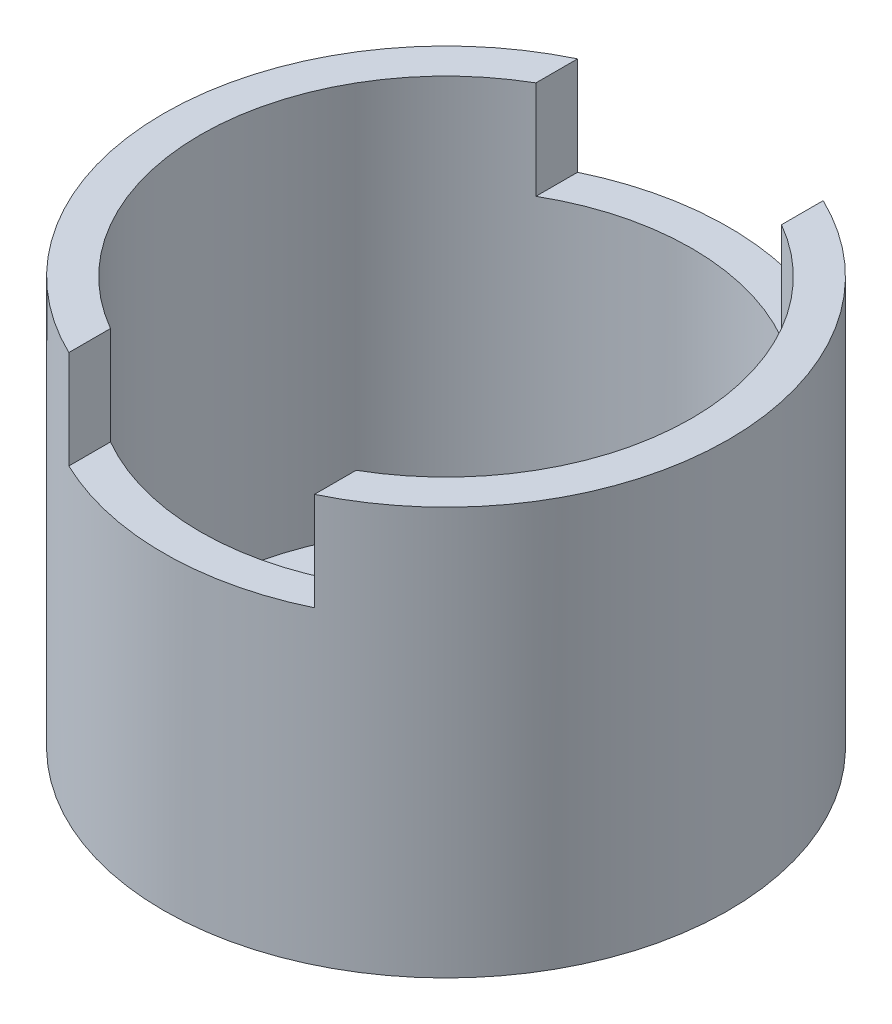
from build123d import *

# Parameters (mm, degrees)
SKETCH_1_R               = 75
SKETCH_1_R_2             = 1.4
SKETCH_1_R_3             = 13.5
EXTRUDE_1_DEPTH          = 3
SKETCH_2_R               = 57.5
SKETCH_2_R_2             = 50
EXTRUDE_3_DEPTH          = 80
CUT_EXTRUDE_1_DEPTH      = 80
CUT_EXTRUDE_1_DEPTH_BACK = 80
SKETCH_4_W               = 50
SKETCH_4_H               = 40
CUT_EXTRUDE_START        = -80
SKETCH_5_R               = 75
SKETCH_5_R_2             = 57.5
CUT_EXTRUDE_2_DEPTH      = 80


with BuildPart() as part:
    # 草图1 → 凸台-拉伸1 (new body)
    with BuildSketch(Plane(origin=(0, 0, 0), x_dir=(1, 0, 0), z_dir=(0, 1, 0))):
        Circle(SKETCH_1_R)
        with Locations((11.5, 11.5)):
            Circle(SKETCH_1_R_2, mode=Mode.SUBTRACT)
        with Locations((-11.5, 11.5)):
            Circle(SKETCH_1_R_2, mode=Mode.SUBTRACT)
        with Locations((-11.5, -11.5)):
            Circle(SKETCH_1_R_2, mode=Mode.SUBTRACT)
        with Locations((11.5, -11.5)):
            Circle(SKETCH_1_R_2, mode=Mode.SUBTRACT)
        Circle(SKETCH_1_R_3, mode=Mode.SUBTRACT)
    extrude(amount=EXTRUDE_1_DEPTH)

    # 草图2 → 凸台-拉伸3 (add)
    with BuildSketch(Plane(origin=(0, 3, 0), x_dir=(1, 0, 0), z_dir=(0, 1, 0))):
        Circle(SKETCH_2_R)
        Circle(SKETCH_2_R_2, mode=Mode.SUBTRACT)
    extrude(amount=EXTRUDE_3_DEPTH)

    # 草图4 → 切除-拉伸1 (cut, two sides: drawn at the far end of the back side and taken through both)
    with BuildSketch(Plane.XY.offset(-CUT_EXTRUDE_1_DEPTH_BACK)):
        with Locations((0, 83)):
            Rectangle(SKETCH_4_W, SKETCH_4_H)
    extrude(amount=CUT_EXTRUDE_1_DEPTH + CUT_EXTRUDE_1_DEPTH_BACK, mode=Mode.SUBTRACT)

    # 草图5 → 切除-拉伸2 (cut)
    with BuildSketch(Plane(origin=(0, 3, 0), x_dir=(1, 0, 0), z_dir=(0, 1, 0)).offset(CUT_EXTRUDE_START)):
        Circle(SKETCH_5_R)
        Circle(SKETCH_5_R_2, mode=Mode.SUBTRACT)
    extrude(amount=CUT_EXTRUDE_2_DEPTH, mode=Mode.SUBTRACT)


solid = part.part
